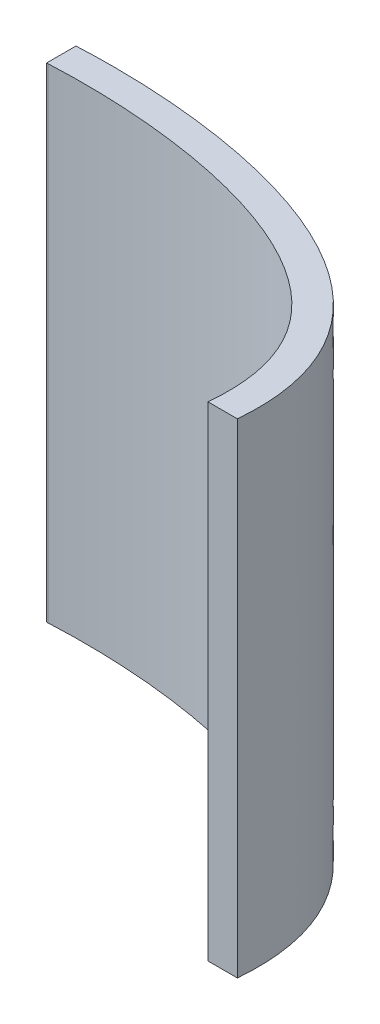
from build123d import *

# Parameters (mm, degrees)
BOSS_EXTRUDE1_DEPTH = 66


with BuildPart() as part:
    # Sketch1 → Boss-Extrude1 (new body)
    with BuildSketch(Plane(origin=(0, 0, 0), x_dir=(1, 0, 0), z_dir=(0, 1, 0))):
        with BuildLine():
            Line((179.594560701, 98.74876777), (179.579673978, 98.403989326))
            Line((179.579673978, 98.403989326), (183.579673978, 98.403989326))
            add(Edge.make_bspline(
                [(128.579673978, 131.403989326), (150.817891371, 132.515318451), (186.002119087, 126.40376225), (183.579673978, 98.403989326)],
                knots=[0, 0, 0, 0, 1, 1, 1, 1], degree=3))
            Line((128.579673978, 131.403989326), (128.579673978, 127.403989326))
            Line((128.579673978, 127.403989326), (128.779320198, 127.408974759))
            add(Edge.make_bspline(
                [(128.779320198, 127.408974759), (129.456925245, 127.442837285), (130.796469522, 127.49505496), (133.608856634, 127.544195588), (137.251969936, 127.49028904), (141.777282014, 127.221776911), (147.898035457, 126.565632752), (155.516447723, 125.140481347), (163.959933839, 122.341583271), (169.876032605, 119.055757918), (173.667431344, 115.871614333), (176.001562959, 113.207973184), (177.804863705, 110.248156926), (178.852838991, 107.484701632), (179.396589336, 105.04819852), (179.647182857, 103.096696056), (179.714900135, 101.353981419), (179.678303178, 99.894033889), (179.627270776, 99.126846368), (179.594560701, 98.74876777)],
                knots=[0, 0, 0, 0, 0.03125, 0.0625, 0.125, 0.1875, 0.25, 0.375, 0.5, 0.625, 0.6875, 0.75, 0.8125, 0.875, 0.90625, 0.9375, 0.96875, 0.984375, 1, 1, 1, 1], degree=3))
        make_face()
    extrude(amount=BOSS_EXTRUDE1_DEPTH)


solid = part.part
